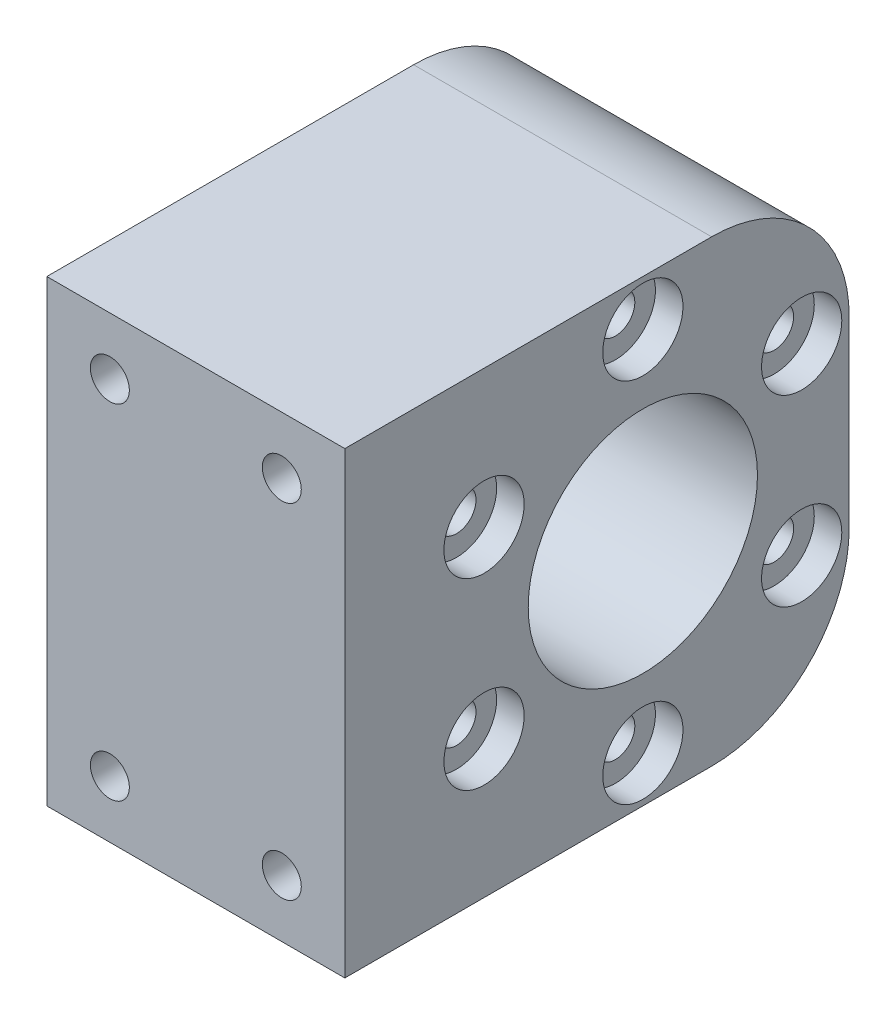
from build123d import *

# Parameters (mm, degrees)
CROQUIS1_W                                           = 26
CROQUIS1_H                                           = 40
SALIENTE_EXTRUIR1_DEPTH                              = 26
TALADRO_DE_MARGEN_PARA_M31_D                         = 3.4
TALADRO_DE_MARGEN_PARA_M31_DEPTH                     = 15
TALADRO_DE_MARGEN_PARA_M31_TIP                       = 1.021463052
REFRENTADO_PARA_TORNILLO_CON_CABEZA_TRON_D           = 3.4
REFRENTADO_PARA_TORNILLO_CON_CABEZA_TRON_CBORE_D     = 7
REFRENTADO_PARA_TORNILLO_CON_CABEZA_TRON_CBORE_DEPTH = 2.4
CROQUIS7_R                                           = 10
CORTAR_EXTRUIR1_DEPTH                                = 42.856899073
CROQUIS9_W                                           = 8
CROQUIS9_H                                           = 40
CORTAR_EXTRUIR3_DEPTH                                = 42.856899073
REDONDEO3_R                                          = 12


with BuildPart() as part:
    # Croquis1 → Saliente-Extruir1 (new, symmetric)
    with BuildSketch(Plane.XY):
        Rectangle(CROQUIS1_W, CROQUIS1_H)
    extrude(amount=SALIENTE_EXTRUIR1_DEPTH, both=True)

    # Taladro de margen para M31
    with Locations(Plane.XY.offset(26)):
        with Locations((-7.5, 15), (7.5, -15), (7.5, 15), (-7.5, -15)):
            Hole(TALADRO_DE_MARGEN_PARA_M31_D / 2, depth=TALADRO_DE_MARGEN_PARA_M31_DEPTH)
            with Locations((0, 0, -(TALADRO_DE_MARGEN_PARA_M31_DEPTH + TALADRO_DE_MARGEN_PARA_M31_TIP / 2))):  # 118° drill point
                Cone(0, TALADRO_DE_MARGEN_PARA_M31_D / 2, TALADRO_DE_MARGEN_PARA_M31_TIP, mode=Mode.SUBTRACT)

    # Refrentado para tornillo con cabeza troncocónica de M31 (through all)
    with Locations(Plane(origin=(13, 0, 0), x_dir=(0, 0, -1), z_dir=(1, 0, 0))):
        with Locations((0, 16), (13.856406461, 8), (13.856406461, -8), (0, -16), (-13.856406461, -8), (-13.856406461, 8)):
            CounterBoreHole(REFRENTADO_PARA_TORNILLO_CON_CABEZA_TRON_D / 2, REFRENTADO_PARA_TORNILLO_CON_CABEZA_TRON_CBORE_D / 2, REFRENTADO_PARA_TORNILLO_CON_CABEZA_TRON_CBORE_DEPTH)

    # Croquis7 → Cortar-Extruir1 (cut, through all)
    with BuildSketch(Plane.ZY.offset(13)):
        Circle(CROQUIS7_R)
    extrude(amount=-CORTAR_EXTRUIR1_DEPTH, mode=Mode.SUBTRACT)

    # Croquis9 → Cortar-Extruir3 (cut, through all)
    with BuildSketch(Plane(origin=(13, 0, 0), x_dir=(0, 0, -1), z_dir=(1, 0, 0))):
        with Locations((22, 0)):
            Rectangle(CROQUIS9_W, CROQUIS9_H)
    extrude(amount=-CORTAR_EXTRUIR3_DEPTH, mode=Mode.SUBTRACT)

    # Redondeo3
    redondeo3_edges = [part.edges().sort_by_distance(p)[0] for p in [
        (0, -20, -18),
        (0, 20, -18),
    ]]
    fillet(redondeo3_edges, radius=REDONDEO3_R)


solid = part.part
